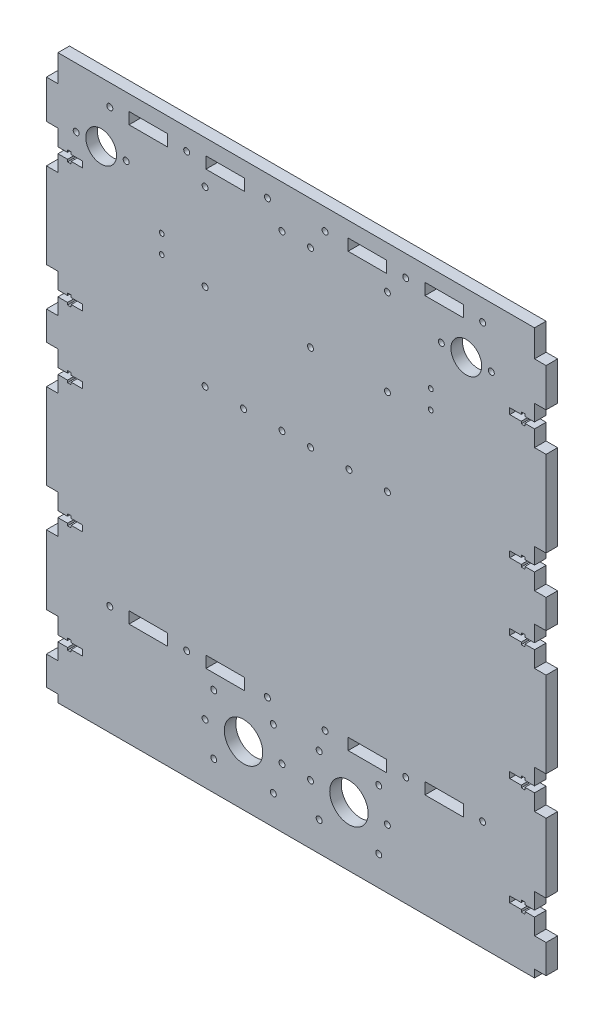
from build123d import *

# Parameters (mm, degrees)
SKETCH1_W           = 260
SKETCH1_H           = 270
BOSS_EXTRUDE1_DEPTH = 6
SKETCH2_W           = 20
SKETCH2_H           = 6
CUT_EXTRUDE1_DEPTH  = 6
SKETCH3_W           = 6
SKETCH3_H           = 20
CUT_EXTRUDE2_DEPTH  = 10
SKETCH4_R           = 8
CUT_EXTRUDE3_DEPTH  = 10
SKETCH5_R           = 8
SKETCH5_R_2         = 1.55
CUT_EXTRUDE4_DEPTH  = 6
SKETCH6_W           = 260
SKETCH6_H           = 6
BOSS_EXTRUDE2_DEPTH = 5
CUT_EXTRUDE6_DEPTH  = 10
SKETCH9_R           = 1.55
CUT_EXTRUDE7_DEPTH  = 10
BOSS_EXTRUDE3_DEPTH = 6
SKETCH11_R          = 1.55
SKETCH11_R_2        = 10
CUT_EXTRUDE9_DEPTH  = 10
SKETCH13_W          = 248
SKETCH13_H          = 6
BOSS_EXTRUDE4_DEPTH = 14
SKETCH14_W          = 248
SKETCH14_H          = 6
BOSS_EXTRUDE5_DEPTH = 4
SKETCH15_R          = 1.55
SKETCH15_W          = 20
SKETCH15_H          = 6
CUT_EXTRUDE10_DEPTH = 10
SKETCH16_R          = 1.25
CUT_EXTRUDE11_DEPTH = 10


with BuildPart() as part:
    # Sketch1 → Boss-Extrude1 (new body)
    with BuildSketch(Plane.XY):
        with Locations((130, 135)):
            Rectangle(SKETCH1_W, SKETCH1_H)
    extrude(amount=BOSS_EXTRUDE1_DEPTH)

    # Sketch2 → Cut-Extrude1 (cut)
    with BuildSketch(Plane(origin=(0, 0, 0), x_dir=(-1, 0, 0), z_dir=(0, 0, -1))):
        with Locations((-207, 53)):
            Rectangle(SKETCH2_W, SKETCH2_H)
        with Locations((-167, 53)):
            Rectangle(SKETCH2_W, SKETCH2_H)
        with BuildLine():
            Line((-220, 0), (-40, 0))
            ThreePointArc((-40, 0), (-130, 10), (-220, 0))
        make_face()
        with Locations((-93, 53)):
            Rectangle(SKETCH2_W, SKETCH2_H)
        with Locations((-53, 53)):
            Rectangle(SKETCH2_W, SKETCH2_H)
    extrude(amount=-CUT_EXTRUDE1_DEPTH, mode=Mode.SUBTRACT)

    # Sketch3 → Cut-Extrude2 (cut)
    with BuildSketch(Plane(origin=(0, 0, 0), x_dir=(-1, 0, 0), z_dir=(0, 0, -1))):
        with Locations((-257, 245)):
            Rectangle(SKETCH3_W, SKETCH3_H)
        with Locations((-257, 180.5)):
            Rectangle(SKETCH3_W, SKETCH3_H)
        with Locations((-257, 145.5)):
            Rectangle(SKETCH3_W, SKETCH3_H)
        with Locations((-257, 81)):
            Rectangle(SKETCH3_W, SKETCH3_H)
        with Locations((-257, 25)):
            Rectangle(SKETCH3_W, SKETCH3_H)
        with Locations((-3, 25)):
            Rectangle(SKETCH3_W, SKETCH3_H)
        with Locations((-3, 145.5)):
            Rectangle(SKETCH3_W, SKETCH3_H)
        with Locations((-3, 180.5)):
            Rectangle(SKETCH3_W, SKETCH3_H)
        with Locations((-3, 245)):
            Rectangle(SKETCH3_W, SKETCH3_H)
        with Locations((-3, 81)):
            Rectangle(SKETCH3_W, SKETCH3_H)
    extrude(amount=-CUT_EXTRUDE2_DEPTH, mode=Mode.SUBTRACT)

    # Sketch4 → Cut-Extrude3 (cut)
    with BuildSketch(Plane.XY.offset(6)):
        with Locations((28.5, 258)):
            Circle(SKETCH4_R)
        with Locations((218.5, 258)):
            Circle(SKETCH4_R)
    extrude(amount=-CUT_EXTRUDE3_DEPTH, mode=Mode.SUBTRACT)

    # Sketch5 → Cut-Extrude4 (cut)
    with BuildSketch(Plane.XY.offset(6)):
        with Locations((28.5, 258)):
            Circle(SKETCH5_R)
        with Locations((15.5, 258)):
            Circle(SKETCH5_R_2)
        with Locations(Location((41.5, 258, 0), (0, 0, 180))):
            Circle(SKETCH5_R_2)
        with Locations((218.5, 258)):
            Circle(SKETCH5_R)
        with Locations((205.5, 258)):
            Circle(SKETCH5_R_2)
        with Locations((231.5, 258)):
            Circle(SKETCH5_R_2)
    extrude(amount=-CUT_EXTRUDE4_DEPTH, mode=Mode.SUBTRACT)

    # Sketch6 → Boss-Extrude2 (add)
    with BuildSketch(Plane(origin=(0, 270, 0), x_dir=(1, 0, 0), z_dir=(0, 1, 0))):
        with Locations((130, -3)):
            Rectangle(SKETCH6_W, SKETCH6_H)
    extrude(amount=BOSS_EXTRUDE2_DEPTH)

    # Sketch8 → Cut-Extrude6 (cut)
    with BuildSketch(Plane.XY.offset(6)):
        Polygon((12.9, 243.45), (12.9, 242.25), (11, 242.25), (11, 243.45), (6, 243.45), (6, 246.55), (11, 246.55), (11, 247.75), (12.9, 247.75), (12.9, 246.55), (18.9, 246.55), (18.9, 243.45), align=None)
        Polygon((12.9, 177.75), (12.9, 178.95), (18.9, 178.95), (18.9, 182.05), (12.9, 182.05), (12.9, 183.25), (11, 183.25), (11, 182.05), (6, 182.05), (6, 178.95), (11, 178.95), (11, 177.75), align=None)
        Polygon((12.9, 143.95), (12.9, 142.75), (11, 142.75), (11, 143.95), (6, 143.95), (6, 147.05), (11, 147.05), (11, 148.25), (12.9, 148.25), (12.9, 147.05), (18.9, 147.05), (18.9, 143.95), align=None)
        Polygon((12.9, 78.25), (12.9, 79.45), (18.9, 79.45), (18.9, 82.55), (12.9, 82.55), (12.9, 83.75), (11, 83.75), (11, 82.55), (6, 82.55), (6, 79.45), (11, 79.45), (11, 78.25), align=None)
        Polygon((12.9, 23.45), (12.9, 22.25), (11, 22.25), (11, 23.45), (6, 23.45), (6, 26.55), (11, 26.55), (11, 27.75), (12.9, 27.75), (12.9, 26.55), (18.9, 26.55), (18.9, 23.45), align=None)
        Polygon((247.1, 27.75), (247.1, 26.55), (241.1, 26.55), (241.1, 23.45), (247.1, 23.45), (247.1, 22.25), (249, 22.25), (249, 23.45), (254, 23.45), (254, 26.55), (249, 26.55), (249, 27.75), align=None)
        Polygon((247.1, 82.55), (247.1, 83.75), (249, 83.75), (249, 82.55), (254, 82.55), (254, 79.45), (249, 79.45), (249, 78.25), (247.1, 78.25), (247.1, 79.45), (241.1, 79.45), (241.1, 82.55), align=None)
        Polygon((247.1, 148.25), (247.1, 147.05), (241.1, 147.05), (241.1, 143.95), (247.1, 143.95), (247.1, 142.75), (249, 142.75), (249, 143.95), (254, 143.95), (254, 147.05), (249, 147.05), (249, 148.25), align=None)
        Polygon((247.1, 182.05), (247.1, 183.25), (249, 183.25), (249, 182.05), (254, 182.05), (254, 178.95), (249, 178.95), (249, 177.75), (247.1, 177.75), (247.1, 178.95), (241.1, 178.95), (241.1, 182.05), align=None)
        Polygon((247.1, 247.75), (247.1, 246.55), (241.1, 246.55), (241.1, 243.45), (247.1, 243.45), (247.1, 242.25), (249, 242.25), (249, 243.45), (254, 243.45), (254, 246.55), (249, 246.55), (249, 247.75), align=None)
    extrude(amount=-CUT_EXTRUDE6_DEPTH, mode=Mode.SUBTRACT)

    # Sketch9 → Cut-Extrude7 (cut)
    with BuildSketch(Plane.XY.offset(6)):
        with Locations((33, 53)):
            Circle(SKETCH9_R)
        with Locations((73, 53)):
            Circle(SKETCH9_R)
        with Locations((115, 53)):
            Circle(SKETCH9_R)
        with Locations(Location((145, 53, 0), (0, 0, 180))):
            Circle(SKETCH9_R)
        with Locations(Location((187, 53, 0), (0, 0, 180))):
            Circle(SKETCH9_R)
        with Locations(Location((227, 53, 0), (0, 0, 180))):
            Circle(SKETCH9_R)
    extrude(amount=-CUT_EXTRUDE7_DEPTH, mode=Mode.SUBTRACT)

    # Sketch12 → Boss-Extrude3 (add)
    with BuildSketch(Plane.XY):
        with BuildLine():
            Line((40, 0), (220, 0))
            ThreePointArc((220, 0), (130, 10), (40, 0))
        make_face()
    extrude(amount=BOSS_EXTRUDE3_DEPTH)

    # Sketch11 → Cut-Extrude9 (cut)
    with BuildSketch(Plane.XY):
        with Locations(Location((177.42949686, 221.837864282, 0), (0, 0, 180))):
            Circle(SKETCH11_R)
        with Locations(Location((177.42949686, 266.837864282, 0), (0, 0, 180))):
            Circle(SKETCH11_R)
        with Locations(Location((157.42949686, 26.837864282, 0), (0, 0, 180))):
            Circle(SKETCH11_R_2)
        with Locations(Location((137.428839649, 26.837864282, 0), (0, 0, 180))):
            Circle(SKETCH11_R)
        with Locations(Location((141.93015407, 42.337864282, 0), (0, 0, 180))):
            Circle(SKETCH11_R)
        with Locations(Location((141.93015407, 11.337864282, 0), (0, 0, 180))):
            Circle(SKETCH11_R)
        with Locations(Location((172.928839649, 11.337864282, 0), (0, 0, 180))):
            Circle(SKETCH11_R)
        with Locations(Location((172.928839649, 42.337864282, 0), (0, 0, 180))):
            Circle(SKETCH11_R)
        with Locations(Location((177.43015407, 26.837864282, 0), (0, 0, 180))):
            Circle(SKETCH11_R)
        with Locations(Location((177.42949686, 176.837864282, 0), (0, 0, 180))):
            Circle(SKETCH11_R)
        with Locations(Location((157.42949686, 176.837864282, 0), (0, 0, 180))):
            Circle(SKETCH11_R)
        with Locations(Location((137.42949686, 176.837864282, 0), (0, 0, 180))):
            Circle(SKETCH11_R)
        with Locations(Location((137.42949686, 266.837864282, 0), (0, 0, 180))):
            Circle(SKETCH11_R)
        with Locations(Location((137.42949686, 221.837864282, 0), (0, 0, 180))):
            Circle(SKETCH11_R)
        with Locations(Location((122.57050314, 266.837864282, 0), (0, 0, 180))):
            Circle(SKETCH11_R)
        with Locations(Location((122.57050314, 176.837864282, 0), (0, 0, 180))):
            Circle(SKETCH11_R)
        with Locations(Location((102.57050314, 176.837864282, 0), (0, 0, 180))):
            Circle(SKETCH11_R)
        with Locations(Location((82.57050314, 176.837864282, 0), (0, 0, 180))):
            Circle(SKETCH11_R)
        with Locations(Location((82.56984593, 26.837864282, 0), (0, 0, 180))):
            Circle(SKETCH11_R)
        with Locations(Location((87.071160351, 42.337864282, 0), (0, 0, 180))):
            Circle(SKETCH11_R)
        with Locations(Location((87.071160351, 11.337864282, 0), (0, 0, 180))):
            Circle(SKETCH11_R)
        with Locations(Location((118.06984593, 11.337864282, 0), (0, 0, 180))):
            Circle(SKETCH11_R)
        with Locations(Location((118.06984593, 42.337864282, 0), (0, 0, 180))):
            Circle(SKETCH11_R)
        with Locations(Location((122.571160351, 26.837864282, 0), (0, 0, 180))):
            Circle(SKETCH11_R)
        with Locations(Location((102.57050314, 26.837864282, 0), (0, 0, 180))):
            Circle(SKETCH11_R_2)
        with Locations(Location((82.57050314, 266.837864282, 0), (0, 0, 180))):
            Circle(SKETCH11_R)
        with Locations(Location((82.57050314, 221.837864282, 0), (0, 0, 180))):
            Circle(SKETCH11_R)
    extrude(amount=CUT_EXTRUDE9_DEPTH, mode=Mode.SUBTRACT)

    # Sketch13 → Boss-Extrude4 (add)
    with BuildSketch(Plane(origin=(0, 275, 0), x_dir=(1, 0, 0), z_dir=(0, 1, 0))):
        with Locations((130, -3)):
            Rectangle(SKETCH13_W, SKETCH13_H)
    extrude(amount=BOSS_EXTRUDE4_DEPTH)

    # Sketch14 → Boss-Extrude5 (add)
    with BuildSketch(Plane.XZ):
        with Locations((130, 3)):
            Rectangle(SKETCH14_W, SKETCH14_H)
    extrude(amount=BOSS_EXTRUDE5_DEPTH)

    # Sketch15 → Cut-Extrude10 (cut)
    with BuildSketch(Plane.XY.offset(6)):
        with Locations(Location((227, 53, 0), (0, 0, 180))):
            Circle(SKETCH15_R)
        with Locations(Location((187, 53, 0), (0, 0, 180))):
            Circle(SKETCH15_R)
        with Locations(Location((145, 53, 0), (0, 0, 180))):
            Circle(SKETCH15_R)
        with Locations((115, 53)):
            Circle(SKETCH15_R)
        with Locations((73, 53)):
            Circle(SKETCH15_R)
        with Locations((33, 53)):
            Circle(SKETCH15_R)
        with Locations((33, 278)):
            Circle(SKETCH15_R)
        with Locations((73, 278)):
            Circle(SKETCH15_R)
        with Locations((115, 278)):
            Circle(SKETCH15_R)
        with Locations((145, 278)):
            Circle(SKETCH15_R)
        with Locations((187, 278)):
            Circle(SKETCH15_R)
        with Locations((227, 278)):
            Circle(SKETCH15_R)
        with Locations((207, 53)):
            Rectangle(SKETCH15_W, SKETCH15_H)
        with Locations((167, 53)):
            Rectangle(SKETCH15_W, SKETCH15_H)
        with Locations((93, 53)):
            Rectangle(SKETCH15_W, SKETCH15_H)
        with Locations((53, 53)):
            Rectangle(SKETCH15_W, SKETCH15_H)
        with Locations((53, 278)):
            Rectangle(SKETCH15_W, SKETCH15_H)
        with Locations((93, 278)):
            Rectangle(SKETCH15_W, SKETCH15_H)
        with Locations((167, 278)):
            Rectangle(SKETCH15_W, SKETCH15_H)
        with Locations((207, 278)):
            Rectangle(SKETCH15_W, SKETCH15_H)
    extrude(amount=-CUT_EXTRUDE10_DEPTH, mode=Mode.SUBTRACT)

    # Sketch16 → Cut-Extrude11 (cut)
    with BuildSketch(Plane.XY.offset(6)):
        with Locations((60, 225)):
            Circle(SKETCH16_R)
        with Locations((60, 234.6)):
            Circle(SKETCH16_R)
        with Locations(Location((200, 234.6, 0), (0, 0, 180))):
            Circle(SKETCH16_R)
        with Locations(Location((200, 225, 0), (0, 0, 180))):
            Circle(SKETCH16_R)
    extrude(amount=-CUT_EXTRUDE11_DEPTH, mode=Mode.SUBTRACT)


solid = part.part
